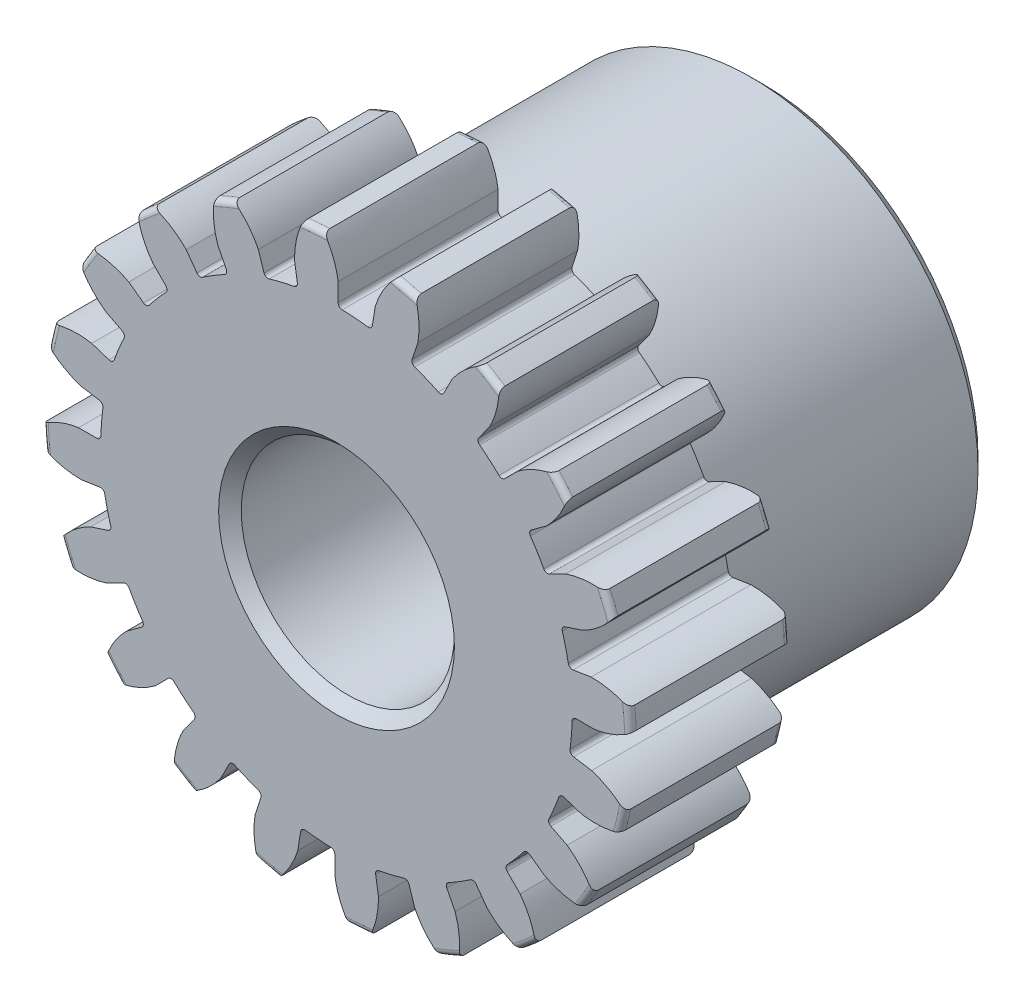
from build123d import *

# Parameters (mm, degrees)
SKETCH1_R                = 8.763
BOSS_EXTRUDE1_DEPTH      = 4.7625
SKETCH2_W                = 7.9375
SKETCH2_H                = 6.746875
FILLET2_R                = 0.17526
CUT_EXTRUDE1_DEPTH       = 18.74458616
FILLET1_R                = 0.12468225
CIRPATTERN1_COUNT        = 20
FILLET1_OF_CIRPATTERN1_R = 0.12468225
SKETCH5_R                = 3.175
CUT_EXTRUDE2_DEPTH       = 18.736743627
CHAMFER1_SIZE            = 0.33734375


with BuildPart() as part:
    # Sketch1 → Boss-Extrude1 (new body)
    with BuildSketch(Plane.XY):
        Circle(SKETCH1_R)
    extrude(amount=-BOSS_EXTRUDE1_DEPTH)

    # Sketch2 → Revolve1 (revolve)
    with BuildSketch(Plane(origin=(0, 0, 0), x_dir=(0, 0, -1), z_dir=(1, 0, 0)), mode=Mode.PRIVATE) as revolve1_sk:
        with Locations((8.73125, 3.3734375)):
            Rectangle(SKETCH2_W, SKETCH2_H)
    revolve(revolve1_sk.sketch.rotate(Axis((0, 0, -4.7625), (0, 0, -1)), 90), axis=Axis((0, 0, -4.7625), (0, 0, -1)))

    # Fillet2
    fillet2_edges = [part.edges().sort_by_distance(p)[0] for p in [
        (-8.763, 0, 0),
        (-8.763, 0, -4.7625),
        (-6.746875, 0, -4.7625),
    ]]
    fillet(fillet2_edges, radius=FILLET2_R)

    # Sketch4 → Cut-Extrude1 (cut, through all)
    with BuildSketch(Plane.XY):
        with BuildLine():
            Line((0.048846981, 7.684516648), (0.048846981, 7.018961282))
            ThreePointArc((0.048846981, 7.018961282), (0.550715976, 6.99749351), (1.049764409, 6.940187187))
            Line((1.049764409, 6.940187187), (1.153880448, 7.597548424))
            add(Edge.make_bspline(
                [(1.88040901, 8.728156907), (1.351039199, 8.244936173), (1.153880448, 7.597548424)],
                knots=[0, 0, 0, 1, 1, 1], degree=2))
            ThreePointArc((1.88040901, 8.728156907), (0.700517295, 8.900895267), (-0.491870224, 8.91485977))
            add(Edge.make_bspline(
                [(-0.491870224, 8.91485977), (-0.044610416, 8.354776437), (0.048846981, 7.684516648)],
                knots=[0, 0, 0, 1, 1, 1], degree=2))
        make_face()
    cut_extrude1 = extrude(amount=-CUT_EXTRUDE1_DEPTH, mode=Mode.SUBTRACT)

    # Fillet1
    fillet1_edges = [part.edges().sort_by_distance(p)[0] for p in [
        (1.049764409, 6.940187187, -2.38125),
        (0.048846981, 7.018961282, -2.38125),
    ]]
    fillet(fillet1_edges, radius=FILLET1_R)

    # CirPattern1: Cut-Extrude1 ×20 about axis
    cirpattern1_axis = Axis((0, 0, -4.7625), (0, 0, 1))
    for i in range(1, CIRPATTERN1_COUNT):
        add(cut_extrude1.rotate(cirpattern1_axis, i * 360 / CIRPATTERN1_COUNT), mode=Mode.SUBTRACT)

    # Fillet1 of CirPattern1
    fillet1_of_cirpattern1_edges = [part.edges().sort_by_distance(p)[0] for p in [
        (-1.146250503, 6.924905291, -2.38125),
        (-2.122522079, 6.690523412, -2.38125),
        (-3.23006243, 6.231765416, -2.38125),
        (-4.08612389, 5.707170495, -2.38125),
        (-4.99769334, 4.928616924, -2.38125),
        (-5.649747425, 4.165159966, -2.38125),
        (-6.276115206, 3.143021067, -2.38125),
        (-6.660334318, 2.215434558, -2.38125),
        (-6.940187187, 1.049764409, -2.38125),
        (-7.018961282, 0.048846981, -2.38125),
        (-6.924905291, -1.146250503, -2.38125),
        (-6.690523412, -2.122522079, -2.38125),
        (-6.231765416, -3.23006243, -2.38125),
        (-5.707170495, -4.08612389, -2.38125),
        (-4.928616924, -4.99769334, -2.38125),
        (-4.165159966, -5.649747425, -2.38125),
        (-3.143021067, -6.276115206, -2.38125),
        (-2.215434558, -6.660334318, -2.38125),
        (-1.049764409, -6.940187187, -2.38125),
        (-0.048846981, -7.018961282, -2.38125),
        (1.146250503, -6.924905291, -2.38125),
        (2.122522079, -6.690523412, -2.38125),
        (3.23006243, -6.231765416, -2.38125),
        (4.08612389, -5.707170495, -2.38125),
        (4.99769334, -4.928616924, -2.38125),
        (5.649747425, -4.165159966, -2.38125),
        (6.276115206, -3.143021067, -2.38125),
        (6.660334318, -2.215434558, -2.38125),
        (6.940187187, -1.049764409, -2.38125),
        (7.018961282, -0.048846981, -2.38125),
        (6.924905291, 1.146250503, -2.38125),
        (6.690523412, 2.122522079, -2.38125),
        (6.231765416, 3.23006243, -2.38125),
        (5.707170495, 4.08612389, -2.38125),
        (4.928616924, 4.99769334, -2.38125),
        (4.165159966, 5.649747425, -2.38125),
        (3.143021067, 6.276115206, -2.38125),
        (2.215434558, 6.660334318, -2.38125),
    ]]
    fillet(fillet1_of_cirpattern1_edges, radius=FILLET1_OF_CIRPATTERN1_R)

    # Sketch5 → Cut-Extrude2 (cut, through all)
    with BuildSketch(Plane.XY):
        Circle(SKETCH5_R)
    extrude(amount=-CUT_EXTRUDE2_DEPTH, mode=Mode.SUBTRACT)

    # Chamfer1
    chamfer1_edges = [part.edges().sort_by_distance(p)[0] for p in [
        (-6.746875, 0, -12.7),
        (-3.175, 0, -12.7),
        (-3.175, 0, 0),
    ]]
    chamfer(chamfer1_edges, length=CHAMFER1_SIZE)


solid = part.part
